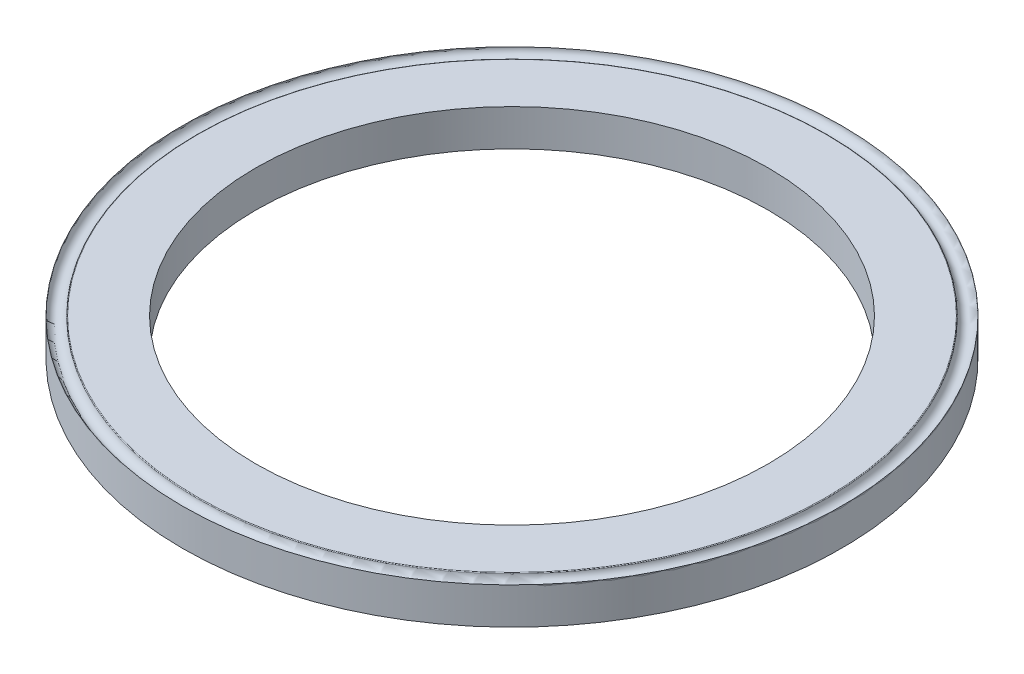
from build123d import *

# Parameters (mm, degrees)
TOP_SKETCH_R   = 4.5
TOP_SKETCH_R_2 = 3.5
TOP_DEPTH      = 0.25


with BuildPart() as part:
    # Top Sketch → Top (new, symmetric)
    with BuildSketch(Plane(origin=(0, 0, 0), x_dir=(1, 0, 0), z_dir=(0, 1, 0))):
        with Locations(Location((0, 0, 0), (0, 0, 270))):
            Circle(TOP_SKETCH_R)
        with Locations(Location((0, 0, 0), (0, 0, 270))):
            Circle(TOP_SKETCH_R_2, mode=Mode.SUBTRACT)
    extrude(amount=TOP_DEPTH, both=True)

    # Crimp Sketch → Crimp (revolve, cut)
    with BuildSketch(Plane.XY, mode=Mode.PRIVATE) as crimp_sk:
        with BuildLine():
            Line((-4.5, 0.25), (-4.290455488, 0.25))
            ThreePointArc((-4.290455488, 0.25), (-4.297197487, 0.247385489), (-4.30041408, 0.240909091))
            ThreePointArc((-4.30041408, 0.240909091), (-4.404550167, 0.150103574), (-4.5, 0.25))
        make_face()
    revolve(crimp_sk.sketch.rotate(Axis((0, 0.25, 0), (0, -1, 0)), 270), axis=Axis((0, 0.25, 0), (0, -1, 0)), mode=Mode.SUBTRACT)


solid = part.part
